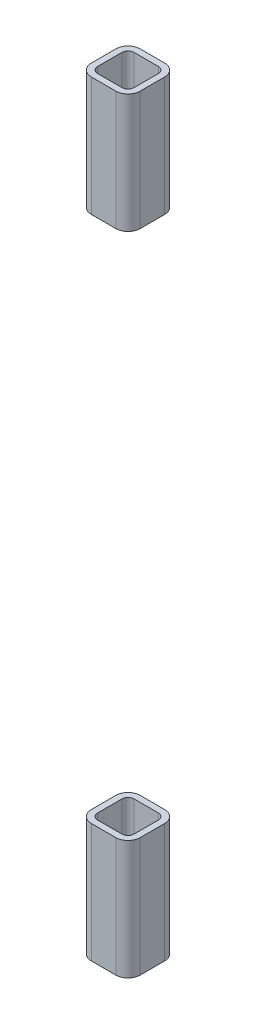
from build123d import *

# Parameters (mm, degrees)
TUBO_CUADRADO_2_X_2_X_0_25_1_DEPTH = 798.4
CROQUIS2_W                         = 12.7
CROQUIS2_H                         = 550
CORTAR_EXTRUIR1_DEPTH              = 101


with BuildPart() as part:
    # Sketch1 → Tubo cuadrado 2 X 2 X 0.25(1) (new body)
    with BuildSketch(Plane(origin=(0, 0, 0), x_dir=(-1, 0, 0), z_dir=(0, 1, 0))):
        with BuildLine():
            Line((-12.7, -25.4), (12.7, -25.4))
            ThreePointArc((12.7, -25.4), (21.680256121, -21.680256121), (25.4, -12.7))
            Line((25.4, -12.7), (25.4, 12.7))
            ThreePointArc((25.4, 12.7), (21.680256121, 21.680256121), (12.7, 25.4))
            Line((12.7, 25.4), (-12.7, 25.4))
            ThreePointArc((-12.7, 25.4), (-21.680256121, 21.680256121), (-25.4, 12.7))
            Line((-25.4, 12.7), (-25.4, -12.7))
            ThreePointArc((-25.4, -12.7), (-21.680256121, -21.680256121), (-12.7, -25.4))
        make_face()
        with BuildLine():
            Line((-12.7, -19.05), (12.7, -19.05))
            ThreePointArc((12.7, -19.05), (17.190128061, -17.190128061), (19.05, -12.7))
            Line((19.05, -12.7), (19.05, 12.7))
            ThreePointArc((19.05, 12.7), (17.190128061, 17.190128061), (12.7, 19.05))
            Line((12.7, 19.05), (-12.7, 19.05))
            ThreePointArc((-12.7, 19.05), (-17.190128061, 17.190128061), (-19.05, 12.7))
            Line((-19.05, 12.7), (-19.05, -12.7))
            ThreePointArc((-19.05, -12.7), (-17.190128061, -17.190128061), (-12.7, -19.05))
        make_face(mode=Mode.SUBTRACT)
    extrude(amount=TUBO_CUADRADO_2_X_2_X_0_25_1_DEPTH)

    # Croquis2 → Cortar-Extruir1 (cut)
    with BuildSketch(Plane.XY.offset(25.4)):
        with Locations((-19.05, 399.2)):
            Rectangle(CROQUIS2_W, CROQUIS2_H)
        Polygon((-12.7, 124.2), (0, 124.2), (12.7, 124.2), (12.7, 674.2), (-12.7, 674.2), align=None)
        with Locations((19.05, 399.2)):
            Rectangle(CROQUIS2_W, CROQUIS2_H)
    extrude(amount=-CORTAR_EXTRUIR1_DEPTH, mode=Mode.SUBTRACT)


with BuildPart() as cortar_extruir1_piece_1:
    # of the separate pieces the step leaves, piece 1, a body of its own (cortar_extruir1_pieces)
    add(part.part.solids().sort_by_distance((25.4, 0, 12.7))[0])


with BuildPart() as cortar_extruir1_piece_2:
    # of the separate pieces the step leaves, piece 2, a body of its own (cortar_extruir1_pieces)
    add(part.part.solids().sort_by_distance((25.4, 674.2, 12.7))[0])


solid = Compound([cortar_extruir1_piece_1.part, cortar_extruir1_piece_2.part])
